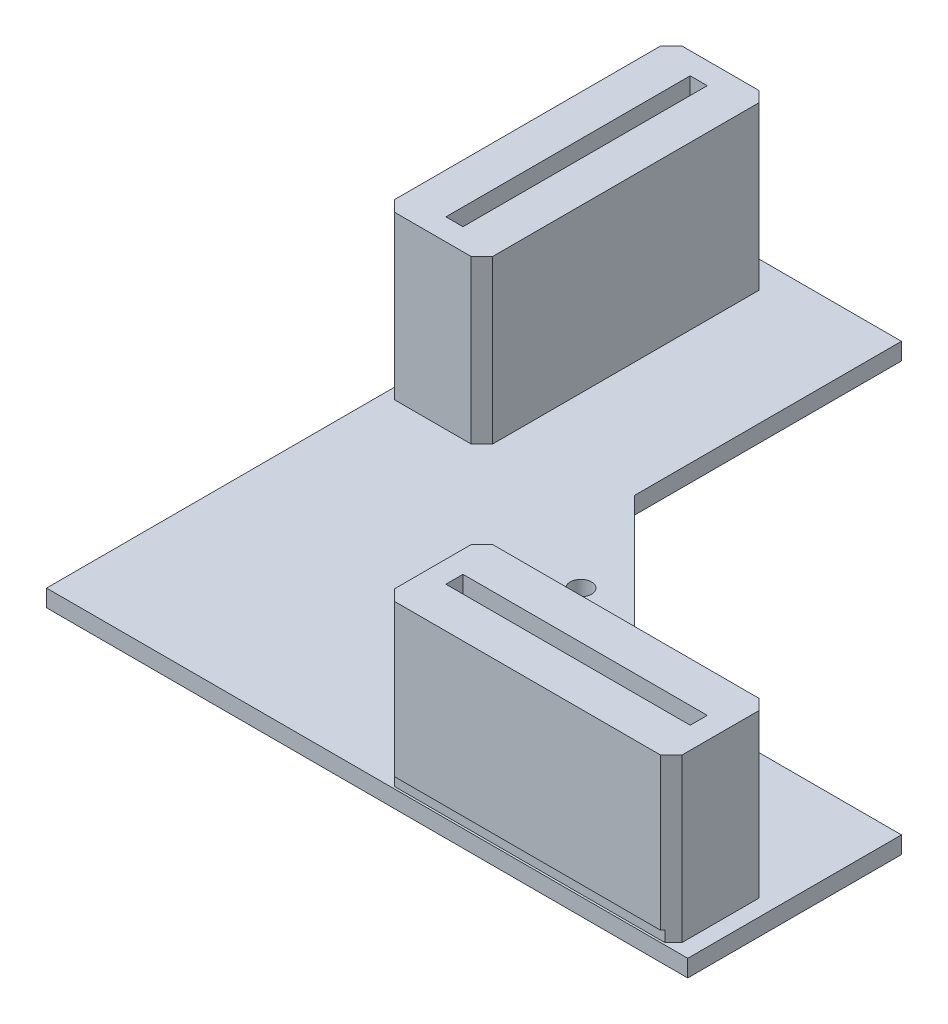
from build123d import *

# Parameters (mm, degrees)
EXTRUDE_1_DEPTH     = 1.6
EXTRUDE_START       = 1.6
EXTRUDE_2_DEPTH     = 15.2
CUT_EXTRUDE_START   = 35
SKETCH_5_W          = 26.92
SKETCH_5_H          = 1
CUT_EXTRUDE_2_DEPTH = 0.2
CUT_EXTRUDE_START_2 = -35
SKETCH_6_W          = 26.92
SKETCH_6_H          = 1
CUT_EXTRUDE_3_DEPTH = 0.2
CUT_EXTRUDE_START_3 = 16.8
SKETCH_7_W          = 1.6
SKETCH_7_H          = 22.86
SKETCH_7_W_2        = 22.86
SKETCH_7_H_2        = 1.6
CUT_EXTRUDE_4_DEPTH = 9
CUT_EXTRUDE_START_4 = 1.6
SKETCH_8_R          = 1
CUT_EXTRUDE_5_DEPTH = 1.6


with BuildPart() as part:
    # 草图2 → 凸台-拉伸1 (new body)
    with BuildSketch(Plane(origin=(0, 0, 0), x_dir=(1, 0, 0), z_dir=(0, 1, 0))):
        Polygon((-15, 0), (-15, 25), (-35, 25), (-35, 0), (-35, -35), (0, -35), (25, -35), (25, -15), (0, -15), align=None)
    extrude(amount=EXTRUDE_1_DEPTH)

    # 草图3 → 凸台-拉伸2 (add)
    with BuildSketch(Plane(origin=(0, 0, 0), x_dir=(1, 0, 0), z_dir=(0, 1, 0)).offset(EXTRUDE_START)):
        Polygon((-34, -3.46), (-35, -2.46), (-35, 22.46), (-34, 23.46), (-26.8, 23.46), (-25.8, 22.46), (-25.8, -2.46), (-26.8, -3.46), align=None)
        Polygon((22.46, -35), (-2.46, -35), (-3.46, -34), (-3.46, -26.8), (-2.46, -25.8), (22.46, -25.8), (23.46, -26.8), (23.46, -34), align=None)
    extrude(amount=EXTRUDE_2_DEPTH)

    # 草图5 → 切除-拉伸2 (cut)
    with BuildSketch(Plane.XY.offset(CUT_EXTRUDE_START)):
        with Locations((10, 2.1)):
            Rectangle(SKETCH_5_W, SKETCH_5_H)
    extrude(amount=-CUT_EXTRUDE_2_DEPTH, mode=Mode.SUBTRACT)

    # 草图6 → 切除-拉伸3 (cut)
    with BuildSketch(Plane(origin=(0, 0, 0), x_dir=(0, 0, -1), z_dir=(1, 0, 0)).offset(CUT_EXTRUDE_START_2)):
        with Locations((10, 2.1)):
            Rectangle(SKETCH_6_W, SKETCH_6_H)
    extrude(amount=CUT_EXTRUDE_3_DEPTH, mode=Mode.SUBTRACT)

    # 草图7 → 切除-拉伸4 (cut)
    with BuildSketch(Plane(origin=(0, 0, 0), x_dir=(1, 0, 0), z_dir=(0, 1, 0)).offset(CUT_EXTRUDE_START_3)):
        with Locations((-30.4, 10)):
            Rectangle(SKETCH_7_W, SKETCH_7_H)
        with Locations((10, -30.4)):
            Rectangle(SKETCH_7_W_2, SKETCH_7_H_2)
    extrude(amount=-CUT_EXTRUDE_4_DEPTH, mode=Mode.SUBTRACT)

    # 草图8 → 切除-拉伸5 (cut)
    with BuildSketch(Plane(origin=(0, 0, 0), x_dir=(1, 0, 0), z_dir=(0, 1, 0)).offset(CUT_EXTRUDE_START_4)):
        with Locations(Location((-10, -10, 0), (0, 0, 90))):
            Circle(SKETCH_8_R)
    extrude(amount=-CUT_EXTRUDE_5_DEPTH, mode=Mode.SUBTRACT)


solid = part.part
